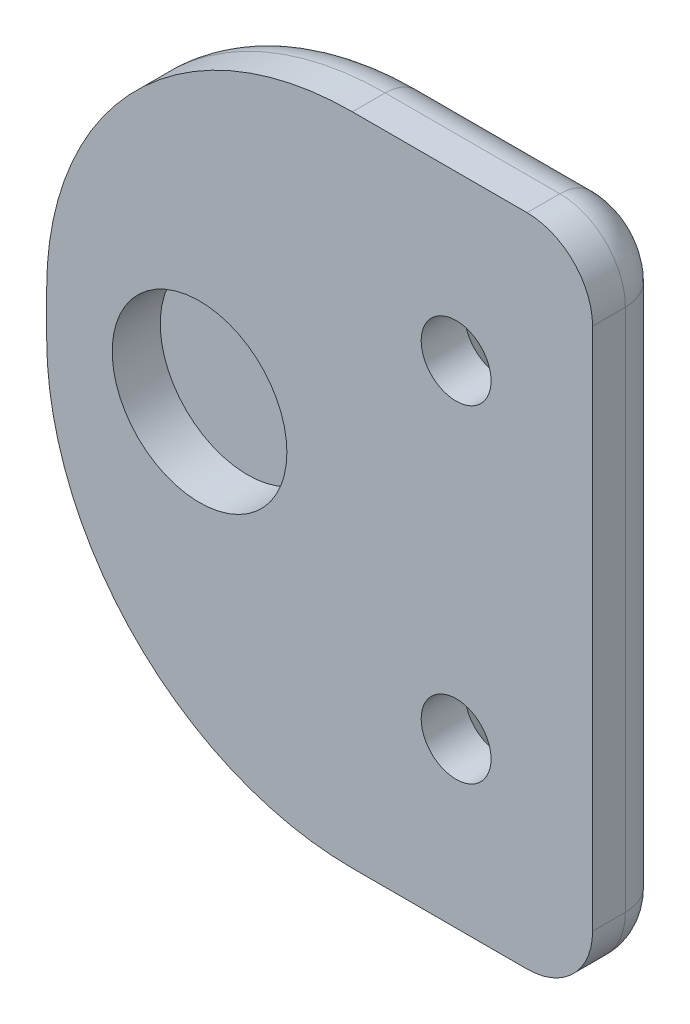
from build123d import *

# Parameters (mm, degrees)
SKETCH_1_R          = 1.6
EXTRUDE_1_DEPTH     = 3.5
SKETCH_2_R          = 4
CUT_EXTRUDE_1_DEPTH = 2.2
FILLET_1_R          = 2
CHAMFER_1_SIZE      = 1.5


with BuildPart() as part:
    # Эскиз1 → Бобышка-Вытянуть1 (new body)
    with BuildSketch(Plane.XY):
        with BuildLine():
            Line((1.5, 15), (9.5, 15))
            ThreePointArc((9.5, 15), (11.621320344, 14.121320344), (12.5, 12))
            Line((12.5, 12), (12.5, -12))
            ThreePointArc((12.5, -12), (11.621320344, -14.121320344), (9.5, -15))
            Line((9.5, -15), (1.5, -15))
            ThreePointArc((1.5, -15), (-8.399494937, -10.899494937), (-12.5, -1))
            Line((-12.5, -1), (-12.5, 1))
            ThreePointArc((-12.5, 1), (-8.399494937, 10.899494937), (1.5, 15))
        make_face()
        with Locations((6.25, 7.5)):
            Circle(SKETCH_1_R, mode=Mode.SUBTRACT)
        with Locations((6.25, -7.5)):
            Circle(SKETCH_1_R, mode=Mode.SUBTRACT)
    extrude(amount=EXTRUDE_1_DEPTH)

    # Эскиз2 → Вырез-Вытянуть1 (cut)
    with BuildSketch(Plane.XY.offset(3.5)):
        with Locations((-5.5, 0)):
            Circle(SKETCH_2_R)
    extrude(amount=-CUT_EXTRUDE_1_DEPTH, mode=Mode.SUBTRACT)

    # Скругление1
    fillet_1_edges = [part.edges().sort_by_distance(p)[0] for p in [
        (12.5, 0, 0),
        (11.621320344, -14.121320344, 0),
        (5.5, -15, 0),
        (-8.399494937, -10.899494937, 0),
        (-12.5, 0, 0),
        (-8.399494937, 10.899494937, 0),
        (5.5, 15, 0),
        (11.621320344, 14.121320344, 0),
    ]]
    fillet(fillet_1_edges, radius=FILLET_1_R)

    # Фаска1
    chamfer_1_edges = [part.edges().sort_by_distance(p)[0] for p in [
        (4.65, 7.5, 0),
        (4.65, -7.5, 0),
    ]]
    chamfer(chamfer_1_edges, length=CHAMFER_1_SIZE)


solid = part.part
